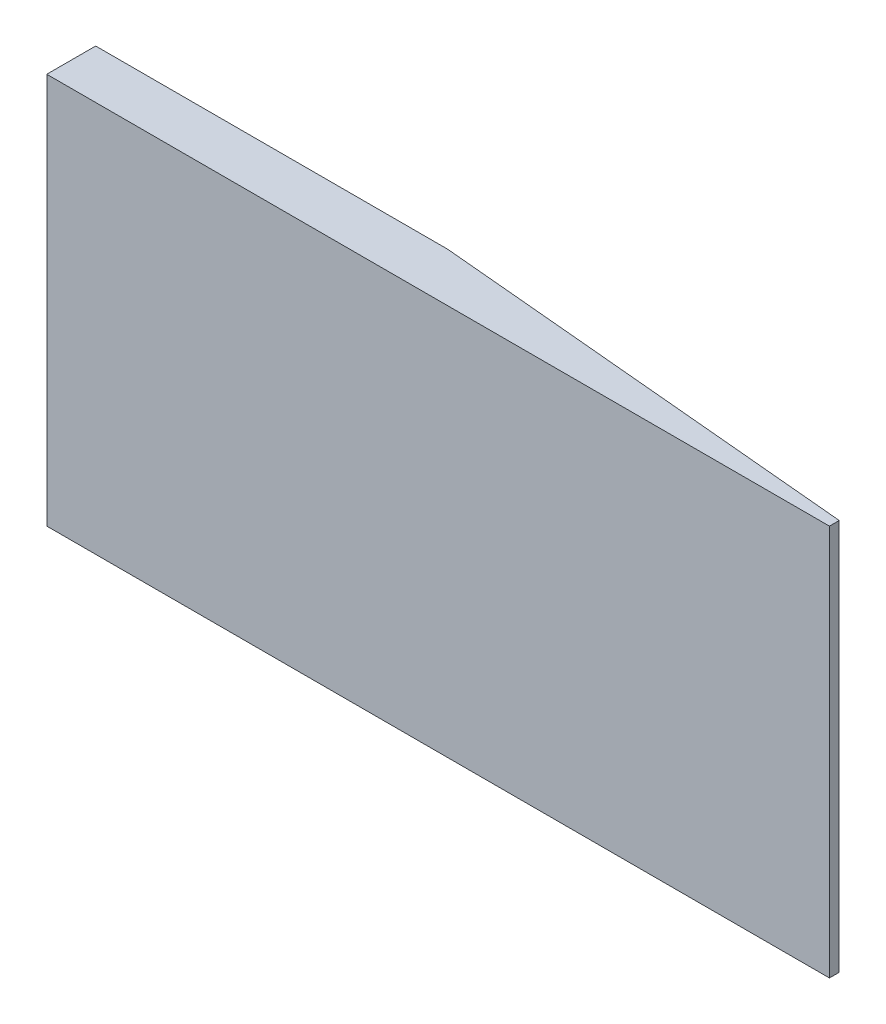
from build123d import *

# Parameters (mm, degrees)
SKETCH2_W           = 50.8
SKETCH2_H           = 25.4
BOSS_EXTRUDE1_DEPTH = 3.175
CHAMFER1_SIZE       = 27.94
CHAMFER1_SIZE2      = 2.54


with BuildPart() as part:
    # Sketch2 → Boss-Extrude1 (new body)
    with BuildSketch(Plane.XY):
        with Locations((220.104652046, 1.5875)):
            Rectangle(SKETCH2_W, SKETCH2_H)
    extrude(amount=BOSS_EXTRUDE1_DEPTH)

    # Chamfer1
    chamfer1_edges = [part.edges().sort_by_distance(p)[0] for p in [
        (245.504652046, 1.5875, 0),
    ]]
    chamfer1_side = [part.faces().sort_by_distance(p)[0] for p in [
        (220.104652046, 1.5875, 0),
    ]]
    chamfer(chamfer1_edges, length=CHAMFER1_SIZE, length2=CHAMFER1_SIZE2, reference=chamfer1_side[0])


solid = part.part
